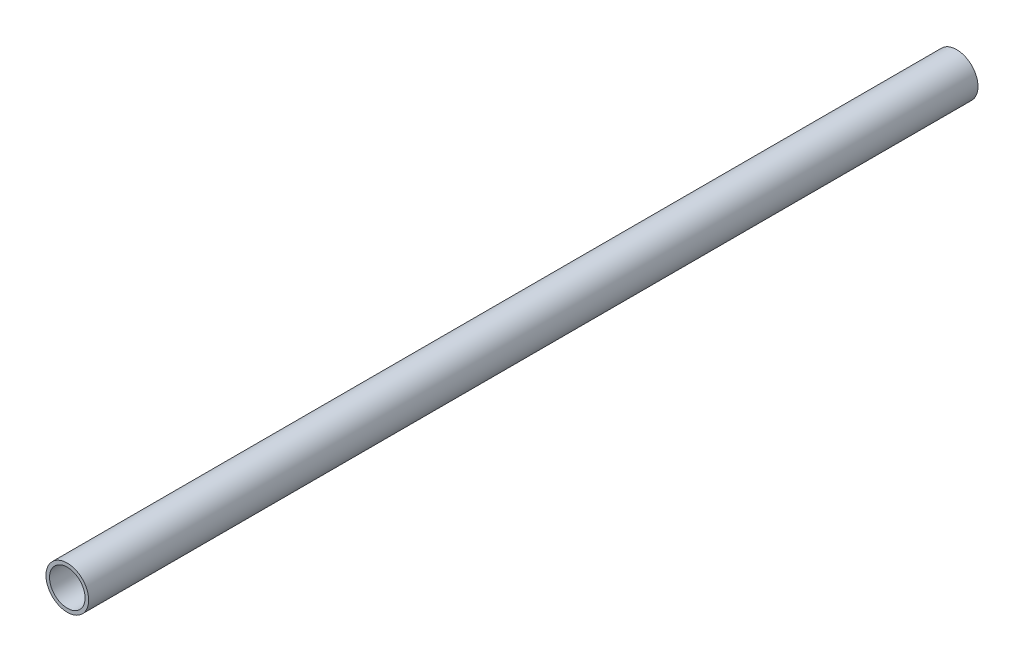
from build123d import *

# Parameters (mm, degrees)
SKETCH1_R           = 6
SKETCH1_R_2         = 5
BOSS_EXTRUDE1_DEPTH = 125


with BuildPart() as part:
    # Sketch1 → Boss-Extrude1 (new, symmetric)
    with BuildSketch(Plane.XY):
        Circle(SKETCH1_R)
        Circle(SKETCH1_R_2, mode=Mode.SUBTRACT)
    extrude(amount=BOSS_EXTRUDE1_DEPTH, both=True)


solid = part.part
